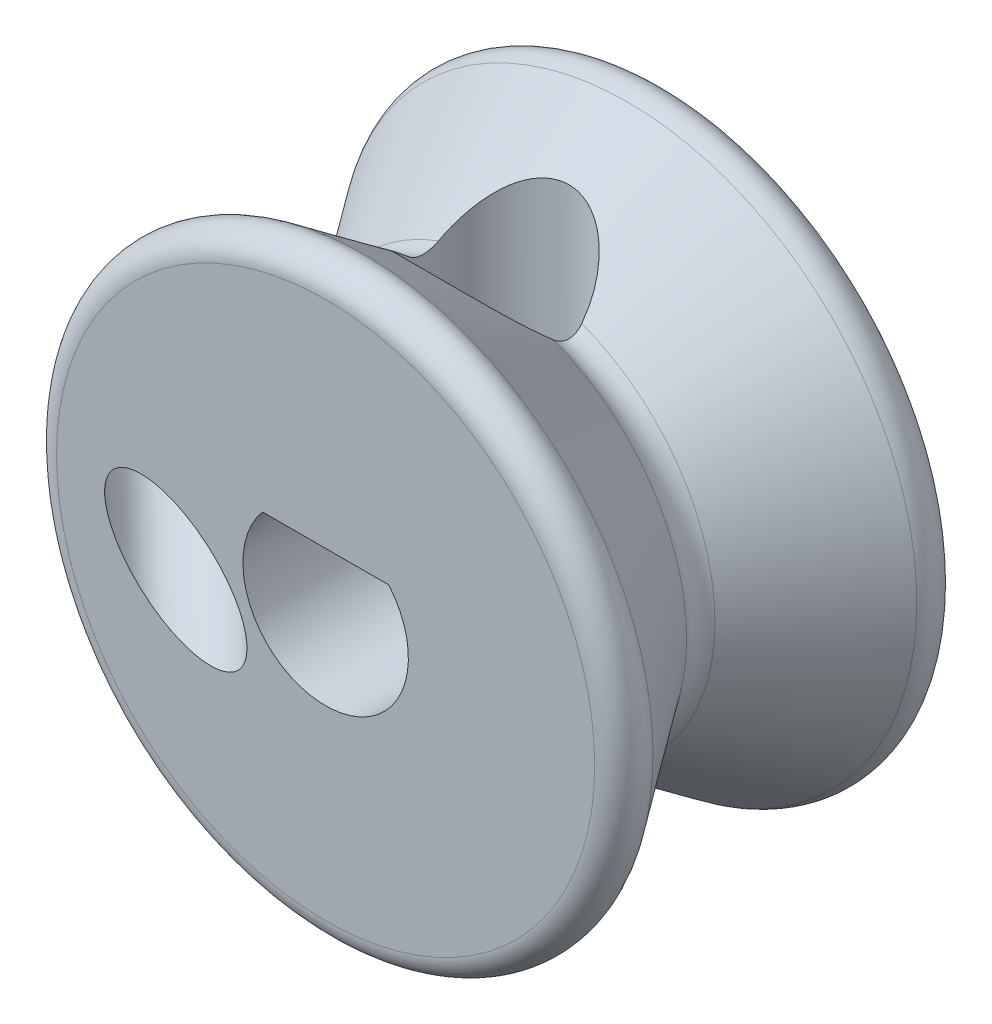
from build123d import *

# Parameters (mm, degrees)
CUT_EXTRUDE1_DEPTH      = 7
CUT_EXTRUDE2_DEPTH      = 0.5
CUT_EXTRUDE2_DEPTH_BACK = 7
SKETCH5_R               = 1.5
SKETCH6_R               = 1
CUT_EXTRUDE3_DEPTH      = 15.204074326


with BuildPart() as part:
    # Sketch3 → Revolve1 (revolve)
    with BuildSketch(Plane(origin=(0, 0, 0), x_dir=(0, 0, -1), z_dir=(1, 0, 0)), mode=Mode.PRIVATE) as revolve1_sk:
        with BuildLine():
            Line((0, 0), (7, 0))
            Line((7, 0), (7, 5.528405338))
            ThreePointArc((7, 5.528405338), (6.72879079, 5.972989159), (6.209380903, 5.935272074))
            Line((6.209380903, 5.935272074), (3.790619097, 4.207585069))
            ThreePointArc((3.790619097, 4.207585069), (3.5, 4.114451805), (3.209380903, 4.207585069))
            Line((3.209380903, 4.207585069), (0.790619097, 5.935272074))
            ThreePointArc((0.790619097, 5.935272074), (0.27120921, 5.972989159), (0, 5.528405338))
            Line((0, 5.528405338), (0, 0))
        make_face()
    revolve(revolve1_sk.sketch.rotate(Axis((0, 0, 0), (0, 0, -1)), 90), axis=Axis((0, 0, 0), (0, 0, -1)))

    # Sketch4 → Cut-Extrude1 (cut)
    with BuildSketch(Plane.XY):
        with BuildLine():
            Line((-1.29614814, 1.1), (1.29614814, 1.1))
            ThreePointArc((1.29614814, 1.1), (0, -1.7), (-1.29614814, 1.1))
        make_face()
    extrude(amount=-CUT_EXTRUDE1_DEPTH, mode=Mode.SUBTRACT)

    # Sketch5 → Cut-Extrude2 (cut, two sides: drawn at the far end of the back side and taken through both)
    with BuildSketch(Plane.XZ.offset(-1.1).offset(-CUT_EXTRUDE2_DEPTH_BACK)):
        with Locations(Location((0, -3.5, 0), (0, 0, 149.779954189))):
            Circle(SKETCH5_R)
    extrude(amount=CUT_EXTRUDE2_DEPTH + CUT_EXTRUDE2_DEPTH_BACK, mode=Mode.SUBTRACT)

    # Sketch6 → Cut-Extrude3 (cut, through all)
    with BuildSketch(Plane(origin=(-3.719471212, 3.156597774, -2.27027027), x_dir=(-0.4225088351551143, 0.39998024596887827, 0.8133277857361964), z_dir=(-0.620423014647787, 0.5265334225455343, -0.5812381937190964))):
        with Locations(Location((-0.01464323, -2.617517623, 0), (0, 0, 358.190705297))):
            Circle(SKETCH6_R)
    extrude(amount=-CUT_EXTRUDE3_DEPTH, mode=Mode.SUBTRACT)


solid = part.part
